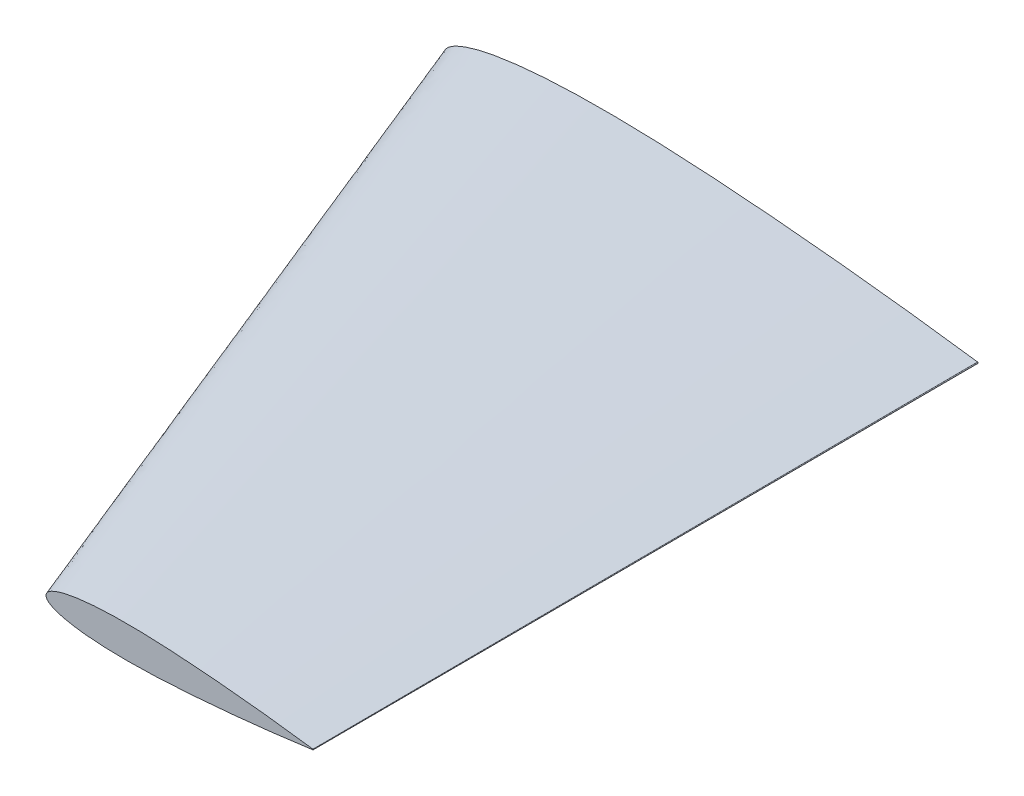
from build123d import *


with BuildPart() as part:
    # Sketch2 for Loft1 → Loft1 section 0
    with BuildSketch(Plane.XY):
        with BuildLine():
            # circular arc as an exact rational Bezier (weights 1, cos(half-angle), 1)
            Bezier((203.2, 0.256032), (203.985299386, 0), (203.2, -0.256032), weights=[1, 0.309972573, 1])
            add(Edge.make_bspline(
                [(203.2, 0.256032), (203.160444006, 0.26158808), (203.002362195, 0.283792432), (202.371452018, 0.372031236), (201.426998001, 0.503929296), (200.170946777, 0.677148757), (198.882114972, 0.854347737), (197.366011284, 1.060826609), (195.626228998, 1.295248031), (193.666888241, 1.556609567), (191.49254302, 1.843034787), (189.108259624, 2.153178269), (186.519557247, 2.484550519), (182.677653876, 2.969453015), (178.584221843, 3.472677933), (174.248732362, 3.991722924), (170.737886785, 4.403934983), (167.065446898, 4.825883481), (163.240198837, 5.256490831), (159.270956546, 5.692668058), (155.167116205, 6.133243682), (150.938101757, 6.575069268), (146.59388185, 7.017326061), (142.1445492, 7.45660377), (137.600565439, 7.891522736), (132.972482524, 8.319062257), (128.271096636, 8.737824539), (123.507416833, 9.144347741), (118.692544385, 9.536813527), (113.837785523, 9.912715546), (108.954416806, 10.269036244), (104.053914357, 10.603540812), (99.147717699, 10.913557285), (92.628697604, 11.289403433), (86.13903698, 11.606483183), (78.126464833, 11.915023622), (71.818514921, 12.088775754), (65.600486036, 12.179117605), (61.056186819, 12.202924123), (56.606542161, 12.181878588), (52.261965901, 12.115034784), (48.032638774, 12.000372627), (43.928344281, 11.838399519), (39.958659254, 11.627951646), (36.132825625, 11.369618862), (32.459852367, 11.063455033), (28.948278923, 10.710016616), (25.606264548, 10.310644367), (22.441513893, 9.866961624), (19.461482357, 9.379795449), (16.672999609, 8.851580621), (14.082483297, 8.284303305), (11.695987669, 7.679886516), (9.518786136, 7.04103794), (7.555679422, 6.369879191), (5.810853962, 5.668728302), (4.287763717, 4.939607963), (2.989310371, 4.184036166), (1.91700592, 3.403293753), (1.072922347, 2.596096448), (0.459095184, 1.760157594), (0.083800287, 0.891391222), (-0.040847769, 0), (0.083800287, -0.891391222), (0.459095184, -1.760157594), (1.072922347, -2.596096448), (1.91700592, -3.403293753), (2.989310371, -4.184036166), (4.287763717, -4.939607963), (5.810853962, -5.668728302), (7.555679422, -6.369879191), (9.518786136, -7.04103794), (11.695987669, -7.679886516), (14.082483297, -8.284303305), (16.672999609, -8.851580621), (19.461482357, -9.379795449), (22.441513893, -9.866961624), (25.606264548, -10.310644367), (28.948278923, -10.710016616), (32.459852367, -11.063455033), (36.132825625, -11.369618862), (39.958659254, -11.627951646), (43.928344281, -11.838399519), (48.032638774, -12.000372627), (52.261965901, -12.115034784), (56.606542161, -12.181878588), (61.056186819, -12.202924123), (65.600486036, -12.179117605), (71.818514921, -12.088775754), (79.747070765, -11.870384121), (87.758573777, -11.532017027), (94.247183136, -11.196091625), (99.147717699, -10.913557285), (104.053914357, -10.603540812), (108.954416806, -10.269036244), (113.837785523, -9.912715546), (118.692544385, -9.536813527), (123.507416833, -9.144347741), (128.271096636, -8.737824539), (132.972482524, -8.319062257), (137.600565439, -7.891522736), (142.1445492, -7.45660377), (146.59388185, -7.017326061), (150.938101757, -6.575069268), (155.167116205, -6.133243682), (159.270956546, -5.692668058), (163.240198837, -5.256490831), (167.065446898, -4.825883481), (170.737886785, -4.403934983), (174.248732362, -3.991722924), (178.584221843, -3.472677933), (182.677653876, -2.969453015), (186.519557247, -2.484550519), (189.108259624, -2.153178269), (191.49254302, -1.843034787), (193.666888241, -1.556609567), (195.626228998, -1.295248031), (197.366011284, -1.060826609), (198.882114972, -0.854347737), (200.170946777, -0.677148757), (201.426998001, -0.503929296), (202.371452018, -0.372031236), (203.002362195, -0.283792432), (203.160444006, -0.26158808), (203.2, -0.256032)],
                knots=[0, 0, 0, 0, 0.000289201, 0.001155766, 0.004612322, 0.007193518, 0.010335793, 0.014031397, 0.018271612, 0.023045847, 0.028342901, 0.03415012, 0.04045376, 0.04723833, 0.062186613, 0.070313724, 0.078851908, 0.087780126, 0.097077521, 0.106722049, 0.116690868, 0.126960505, 0.137507218, 0.148306055, 0.159330765, 0.17055649, 0.181956531, 0.193504043, 0.205171367, 0.2169323, 0.228758169, 0.2406214, 0.252494936, 0.264350287, 0.287897994, 0.299535854, 0.322404759, 0.333584032, 0.344559266, 0.35530596, 0.365799778, 0.37601757, 0.3859373, 0.395537659, 0.404797976, 0.413698812, 0.422221441, 0.430349273, 0.438066019, 0.445356904, 0.452209372, 0.458611567, 0.464554044, 0.47002985, 0.475034902, 0.479569141, 0.483636857, 0.487250263, 0.490431338, 0.493218828, 0.495674086, 0.497891368, 0.5, 0.502108632, 0.504325914, 0.506781172, 0.509568662, 0.512749737, 0.516363143, 0.520430859, 0.524965098, 0.52997015, 0.535445956, 0.541388433, 0.547790628, 0.554643096, 0.561933981, 0.569650727, 0.577778559, 0.586301188, 0.595202024, 0.604462341, 0.6140627, 0.62398243, 0.634200222, 0.64469404, 0.655440734, 0.666415968, 0.677595241, 0.700464146, 0.723839427, 0.735649713, 0.747505064, 0.7593786, 0.771241831, 0.7830677, 0.794828633, 0.806495957, 0.818043469, 0.82944351, 0.840669235, 0.851693945, 0.862492782, 0.873039495, 0.883309132, 0.893277951, 0.902922479, 0.912219874, 0.921148092, 0.929686276, 0.937813387, 0.95276167, 0.95954624, 0.96584988, 0.971657099, 0.976954153, 0.981728388, 0.985968603, 0.989664207, 0.992806482, 0.995387678, 0.998844234, 0.999710799, 1, 1, 1, 1], degree=3))
        make_face()
    # Sketch3 for Loft1 → Loft1 section 1
    with BuildSketch(Plane.XY.offset(254)):
        with BuildLine():
            Bezier((204.215999994, 0.128016), (205.149157327, -1e-09), (204.215999994, -0.128016), weights=[1, 0.135912893, 1])
            add(Edge.make_bspline(
                [(204.215999994, 0.128016), (204.196221998, 0.13079404), (204.117181092, 0.141896216), (203.801726004, 0.186015618), (203.329498995, 0.251964648), (202.701473383, 0.338574378), (202.057057481, 0.427173868), (201.299005637, 0.530413304), (200.429114494, 0.647624016), (199.449444115, 0.778304783), (198.362271505, 0.921517393), (197.170129807, 1.076589135), (195.875778619, 1.242275259), (193.954826933, 1.484726507), (191.908110917, 1.736338966), (189.740366176, 1.995861462), (187.984943388, 2.201967491), (186.148723444, 2.41294174), (184.236099414, 2.628245415), (182.251478269, 2.846334029), (180.199558098, 3.06662184), (178.085050874, 3.287534634), (175.912940921, 3.50866303), (173.688274596, 3.728301885), (171.416282716, 3.945761367), (169.102241258, 4.159531128), (166.751548314, 4.368912269), (164.369708413, 4.57217387), (161.962272189, 4.768406763), (159.534892758, 4.956357773), (157.0932084, 5.134518121), (154.642957176, 5.301770406), (152.189858847, 5.456778642), (148.930348799, 5.644701716), (145.685518488, 5.803241591), (141.679232414, 5.95751181), (138.525257459, 6.044387876), (135.416243016, 6.089558802), (133.144093408, 6.101462061), (130.919271079, 6.090939293), (128.746982949, 6.057517391), (126.632319386, 6.000186313), (124.580172139, 5.919199759), (122.595329626, 5.813975822), (120.682412811, 5.68480943), (118.845926183, 5.531727516), (117.090139461, 5.355008307), (115.419132273, 5.155322183), (113.836756946, 4.933480811), (112.346741178, 4.689897724), (110.952499804, 4.42579031), (109.657241648, 4.142151652), (108.463993834, 3.839943257), (107.375393067, 3.520518969), (106.393839711, 3.184939595), (105.521426981, 2.83436415), (104.759881858, 2.469803981), (104.110655185, 2.092018082), (103.57450296, 1.701646876), (103.152461174, 1.298048223), (102.845547592, 0.880078797), (102.657900144, 0.44569561), (102.595576116, -1e-09), (102.657900144, -0.445695611), (102.845547592, -0.880078798), (103.152461174, -1.298048224), (103.57450296, -1.701646877), (104.110655185, -2.092018083), (104.759881858, -2.469803982), (105.521426981, -2.834364151), (106.393839711, -3.184939596), (107.375393068, -3.52051897), (108.463993834, -3.839943258), (109.657241648, -4.142151653), (110.952499804, -4.425790311), (112.346741178, -4.689897725), (113.836756946, -4.933480812), (115.419132273, -5.155322184), (117.090139461, -5.355008308), (118.845926183, -5.531727517), (120.682412811, -5.684809431), (122.595329626, -5.813975823), (124.580172139, -5.91919976), (126.632319386, -6.000186313), (128.746982949, -6.057517392), (130.919271079, -6.090939294), (133.144093408, -6.101462062), (135.416243016, -6.089558803), (138.525257459, -6.044387877), (142.489535381, -5.93519206), (146.495286886, -5.766008513), (149.739591566, -5.598045812), (152.189858847, -5.456778643), (154.642957176, -5.301770406), (157.0932084, -5.134518122), (159.534892758, -4.956357773), (161.962272189, -4.768406763), (164.369708413, -4.572173871), (166.751548314, -4.36891227), (169.102241258, -4.159531128), (171.416282716, -3.945761368), (173.688274596, -3.728301885), (175.912940921, -3.50866303), (178.085050875, -3.287534634), (180.199558098, -3.066621841), (182.251478269, -2.846334029), (184.236099414, -2.628245415), (186.148723444, -2.412941741), (187.984943388, -2.201967491), (189.740366176, -1.995861462), (191.908110917, -1.736338966), (193.954826933, -1.484726508), (195.875778619, -1.24227526), (197.170129807, -1.076589135), (198.362271505, -0.921517394), (199.449444115, -0.778304783), (200.429114494, -0.647624016), (201.299005637, -0.530413304), (202.057057481, -0.427173868), (202.701473383, -0.338574378), (203.329498995, -0.251964648), (203.801726004, -0.186015618), (204.117181092, -0.141896216), (204.196221998, -0.13079404), (204.215999994, -0.128016)],
                knots=[0, 0, 0, 0, 0.000289201, 0.001155766, 0.004612322, 0.007193518, 0.010335793, 0.014031397, 0.018271612, 0.023045847, 0.028342901, 0.03415012, 0.04045376, 0.04723833, 0.062186613, 0.070313724, 0.078851908, 0.087780126, 0.097077521, 0.106722049, 0.116690868, 0.126960505, 0.137507218, 0.148306055, 0.159330765, 0.17055649, 0.181956531, 0.193504043, 0.205171367, 0.2169323, 0.228758169, 0.2406214, 0.252494936, 0.264350287, 0.287897994, 0.299535854, 0.322404759, 0.333584032, 0.344559266, 0.35530596, 0.365799778, 0.37601757, 0.3859373, 0.395537659, 0.404797976, 0.413698812, 0.422221441, 0.430349273, 0.438066019, 0.445356904, 0.452209372, 0.458611567, 0.464554044, 0.47002985, 0.475034902, 0.479569141, 0.483636857, 0.487250263, 0.490431338, 0.493218828, 0.495674086, 0.497891368, 0.5, 0.502108632, 0.504325914, 0.506781172, 0.509568662, 0.512749737, 0.516363143, 0.520430859, 0.524965098, 0.52997015, 0.535445956, 0.541388433, 0.547790628, 0.554643096, 0.561933981, 0.569650727, 0.577778559, 0.586301188, 0.595202024, 0.604462341, 0.6140627, 0.62398243, 0.634200222, 0.64469404, 0.655440734, 0.666415968, 0.677595241, 0.700464146, 0.723839427, 0.735649713, 0.747505064, 0.7593786, 0.771241831, 0.7830677, 0.794828633, 0.806495957, 0.818043469, 0.82944351, 0.840669235, 0.851693945, 0.862492782, 0.873039495, 0.883309132, 0.893277951, 0.902922479, 0.912219874, 0.921148092, 0.929686276, 0.937813387, 0.95276167, 0.95954624, 0.96584988, 0.971657099, 0.976954153, 0.981728388, 0.985968603, 0.989664207, 0.992806482, 0.995387678, 0.998844234, 0.999710799, 1, 1, 1, 1], degree=3))
        make_face()
    loft()


solid = part.part
